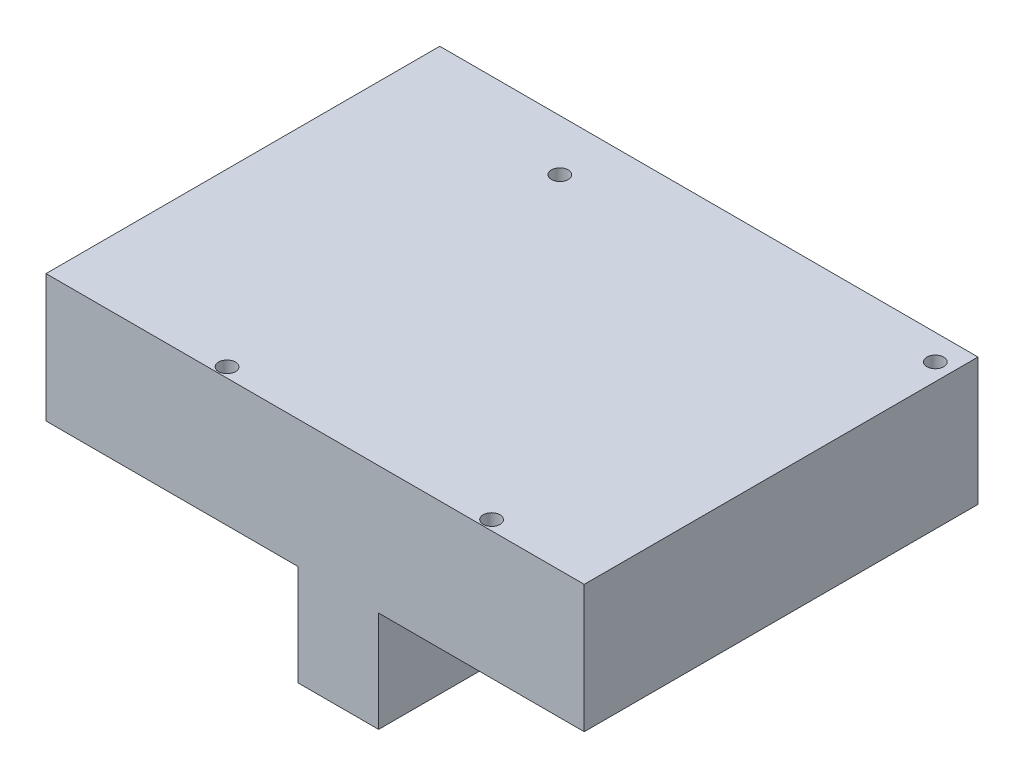
from build123d import *

# Parameters (mm, degrees)
ESQUISSE1_W             = 80.1
ESQUISSE1_H             = 58.6
BOSS_EXTRU_1_DEPTH      = 19
ESQUISSE2_W             = 12
ESQUISSE2_H             = 58.6
BOSS_EXTRU_2_DEPTH      = 15
ESQUISSE3_R             = 1.25
ENL_V_MAT_EXTRU_1_DEPTH = 105.909341815


with BuildPart() as part:
    # Esquisse1 → Boss.-Extru.1 (new body)
    with BuildSketch(Plane(origin=(0, 0, 0), x_dir=(1, 0, 0), z_dir=(0, 1, 0))):
        with Locations((40.05, 29.3)):
            Rectangle(ESQUISSE1_W, ESQUISSE1_H)
    extrude(amount=BOSS_EXTRU_1_DEPTH)

    # Esquisse2 → Boss.-Extru.2 (add)
    with BuildSketch(Plane.XZ):
        with Locations((43.5, -29.3)):
            Rectangle(ESQUISSE2_W, ESQUISSE2_H)
    extrude(amount=BOSS_EXTRU_2_DEPTH)

    # Esquisse3 → Enlèv. mat.-Extru.1 (cut, through all)
    with BuildSketch(Plane(origin=(0, 19, 0), x_dir=(1, 0, 0), z_dir=(0, 1, 0))):
        with Locations(Location((77.56, 54.79, 0), (0, 0, 270))):
            Circle(ESQUISSE3_R)
        with Locations(Location((25.49, 50.98, 0), (0, 0, 270))):
            Circle(ESQUISSE3_R)
        with Locations(Location((25.49, 1.45, 0), (0, 0, 270))):
            Circle(ESQUISSE3_R)
        with Locations(Location((64.86, 1.45, 0), (0, 0, 270))):
            Circle(ESQUISSE3_R)
    extrude(amount=-ENL_V_MAT_EXTRU_1_DEPTH, mode=Mode.SUBTRACT)


solid = part.part
